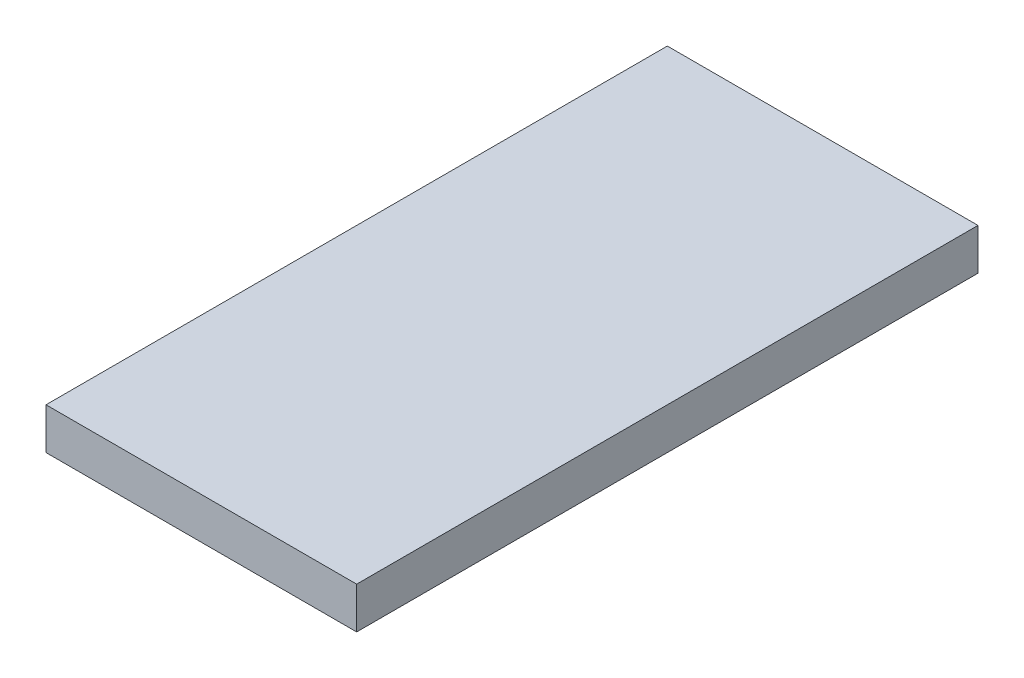
from build123d import *

# Parameters (mm, degrees)
SKETCH1_W           = 1.5
SKETCH1_H           = 3
BOSS_EXTRUDE1_DEPTH = 0.1


with BuildPart() as part:
    # Sketch1 → Boss-Extrude1 (new, symmetric)
    with BuildSketch(Plane(origin=(0, 0, 0), x_dir=(1, 0, 0), z_dir=(0, 1, 0))):
        Rectangle(SKETCH1_W, SKETCH1_H)
    extrude(amount=BOSS_EXTRUDE1_DEPTH, both=True)


solid = part.part
